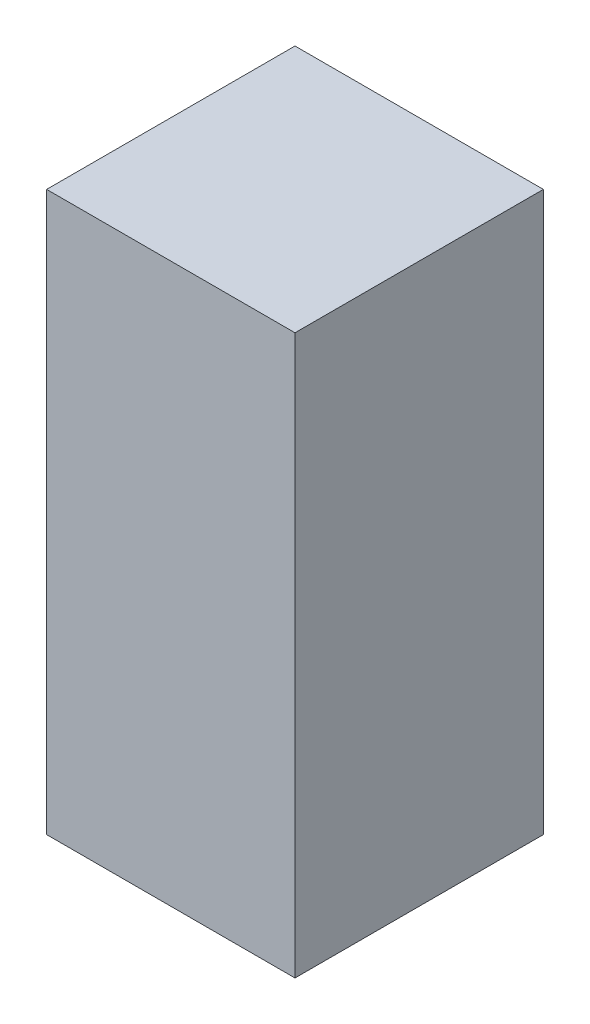
from build123d import *

# Parameters (mm, degrees)
SKETCH1_W           = 40
SKETCH1_H           = 40
BOSS_EXTRUDE1_DEPTH = 90
SKETCH2_R           = 9.525
CUT_EXTRUDE1_DEPTH  = 75
SKETCH3_R           = 3
CUT_EXTRUDE5_DEPTH  = 17
SKETCH5_R           = 2.5
CUT_EXTRUDE6_DEPTH  = 8


with BuildPart() as part:
    # Sketch1 → Boss-Extrude1 (new body)
    with BuildSketch(Plane(origin=(0, 0, 0), x_dir=(1, 0, 0), z_dir=(0, 1, 0))):
        Rectangle(SKETCH1_W, SKETCH1_H)
    extrude(amount=BOSS_EXTRUDE1_DEPTH)

    # Sketch2 → Cut-Extrude1 (cut)
    with BuildSketch(Plane(origin=(0, 0, 0), x_dir=(1, 0, 0), z_dir=(0, 1, 0))):
        Circle(SKETCH2_R)
    extrude(amount=CUT_EXTRUDE1_DEPTH, mode=Mode.SUBTRACT)

    # Sketch3 → Cut-Extrude5 (cut)
    with BuildSketch(Plane.ZY.offset(20)):
        with Locations((0, 68.3)):
            Circle(SKETCH3_R)
    extrude(amount=-CUT_EXTRUDE5_DEPTH, mode=Mode.SUBTRACT)

    # Sketch5 → Cut-Extrude6 (cut)
    with BuildSketch(Plane.ZY.offset(20)):
        with Locations((0, 27.5)):
            Circle(SKETCH5_R)
    extrude(amount=-CUT_EXTRUDE6_DEPTH, mode=Mode.SUBTRACT)


solid = part.part
